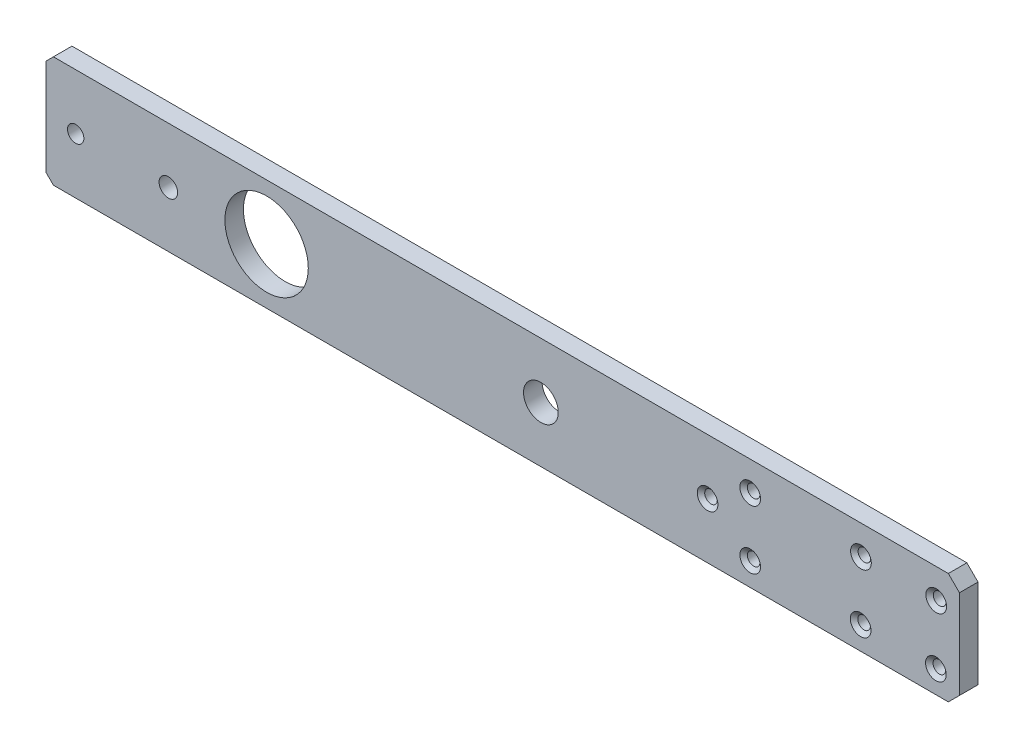
from build123d import *

# Parameters (mm, degrees)
SKETCH1_R                                          = 14.2875
BOSS_EXTRUDE1_DEPTH                                = 3.175
F_6_CLEARANCE_HOLE3_D                              = 4.3053
CUT_EXTRUDE1_DEPTH                                 = 255.792513626
CHAMFER1_SIZE                                      = 3.81
CSK_FOR_6_FLAT_HEAD_MACHINE_SCREW_100_D            = 4.3053
CSK_FOR_6_FLAT_HEAD_MACHINE_SCREW_100_CSINK_D      = 7.0866
CSK_FOR_6_FLAT_HEAD_MACHINE_SCREW_100_CSINK_ANGLE  = 100
SKETCH14_W                                         = 50.8
SKETCH14_H                                         = 38.1
BOSS_EXTRUDE2_DEPTH                                = 6.35
CHAMFER2_SIZE                                      = 2.54
CSK_FOR_10_FLAT_HEAD_MACHINE_SCREW_100_D           = 5.6134
CSK_FOR_10_FLAT_HEAD_MACHINE_SCREW_100_CSINK_D     = 9.779
CSK_FOR_10_FLAT_HEAD_MACHINE_SCREW_100_CSINK_ANGLE = 100
F_1_4_0_25_DIAMETER_HOLE1_D                        = 6.35
F_15_32_0_46875_DIAMETER_HOLE1_D                   = 11.90625


with BuildPart() as part:
    # Sketch1 → Boss-Extrude1 (new, symmetric)
    with BuildSketch(Plane.XY):
        Polygon((0, 19.05), (-28.575, 19.05), (-28.575, -19.05), (0, -19.05), (247.281942035, -19.05), (254, 19.05), align=None)
        Circle(SKETCH1_R, mode=Mode.SUBTRACT)
    extrude(amount=BOSS_EXTRUDE1_DEPTH, both=True)

    # #6 Clearance Hole3 (through all)
    with Locations(Plane.XY.offset(3.175)):
        with Locations((229.388701471, 8.923791784), (229.282371239, -11.346798968), (203.503161764, -11.143926969), (203.608782335, 8.991375351), (165.672159691, 8.991375351), (165.672159691, -11.143926969), (151.067159691, 0)):
            Hole(F_6_CLEARANCE_HOLE3_D / 2)

    # Sketch9 → Cut-Extrude1 (cut, through all)
    with BuildSketch(Plane.XY.offset(3.175)):
        Polygon((254, 19.05), (247.281942035, -19.05), (237.352085197, -19.05), (237.352085197, 19.05), align=None)
    extrude(amount=-CUT_EXTRUDE1_DEPTH, mode=Mode.SUBTRACT)

    # Chamfer1
    chamfer1_edges = [part.edges().sort_by_distance(p)[0] for p in [
        (-28.575, -19.05, 0),
        (-28.575, 19.05, 0),
        (237.352085197, 19.05, 0),
        (237.352085197, -19.05, 0),
    ]]
    chamfer(chamfer1_edges, length=CHAMFER1_SIZE)

    # CSK for #6 Flat Head Machine Screw (100)2 (through all)
    with Locations(Plane.XY.offset(3.175)):
        with Locations((203.608782335, 8.991375351), (203.503161764, -11.143926969), (229.282371239, -11.346798968), (229.388701471, 8.923791784), (165.672159691, 8.991375351), (165.672159691, -11.143926969), (151.067159691, 0)):
            CounterSinkHole(CSK_FOR_6_FLAT_HEAD_MACHINE_SCREW_100_D / 2, CSK_FOR_6_FLAT_HEAD_MACHINE_SCREW_100_CSINK_D / 2, counter_sink_angle=CSK_FOR_6_FLAT_HEAD_MACHINE_SCREW_100_CSINK_ANGLE)

    # Sketch14 → Boss-Extrude2 (add, through all)
    with BuildSketch(Plane.XY.offset(3.175)):
        with Locations((-50.165, 0)):
            Rectangle(SKETCH14_W, SKETCH14_H)
    extrude(amount=-BOSS_EXTRUDE2_DEPTH)

    # Chamfer2
    chamfer2_edges = [part.edges().sort_by_distance(p)[0] for p in [
        (-75.565, -19.05, 0),
        (-75.565, 19.05, 0),
    ]]
    chamfer(chamfer2_edges, length=CHAMFER2_SIZE)

    # CSK for #10 Flat Head Machine Screw (100)1 (through all)
    with Locations(Plane(origin=(0, 0, -3.175), x_dir=(1, 0, 0), z_dir=(0, 0, -1))):
        with Locations((-65.405, 0)):
            CounterSinkHole(CSK_FOR_10_FLAT_HEAD_MACHINE_SCREW_100_D / 2, CSK_FOR_10_FLAT_HEAD_MACHINE_SCREW_100_CSINK_D / 2, counter_sink_angle=CSK_FOR_10_FLAT_HEAD_MACHINE_SCREW_100_CSINK_ANGLE)

    # 1/4 (0.25) Diameter Hole1 (through all)
    with Locations(Plane(origin=(0, 0, -3.175), x_dir=(-1, 0, 0), z_dir=(0, 0, -1))):
        with Locations((33.655, 0)):
            Hole(F_1_4_0_25_DIAMETER_HOLE1_D / 2)

    # 15/32 (0.46875) Diameter Hole1 (through all)
    with Locations(Plane(origin=(0, 0, -3.175), x_dir=(-1, 0, 0), z_dir=(0, 0, -1))):
        with Locations((-93.967218212, 0)):
            Hole(F_15_32_0_46875_DIAMETER_HOLE1_D / 2)


solid = part.part
